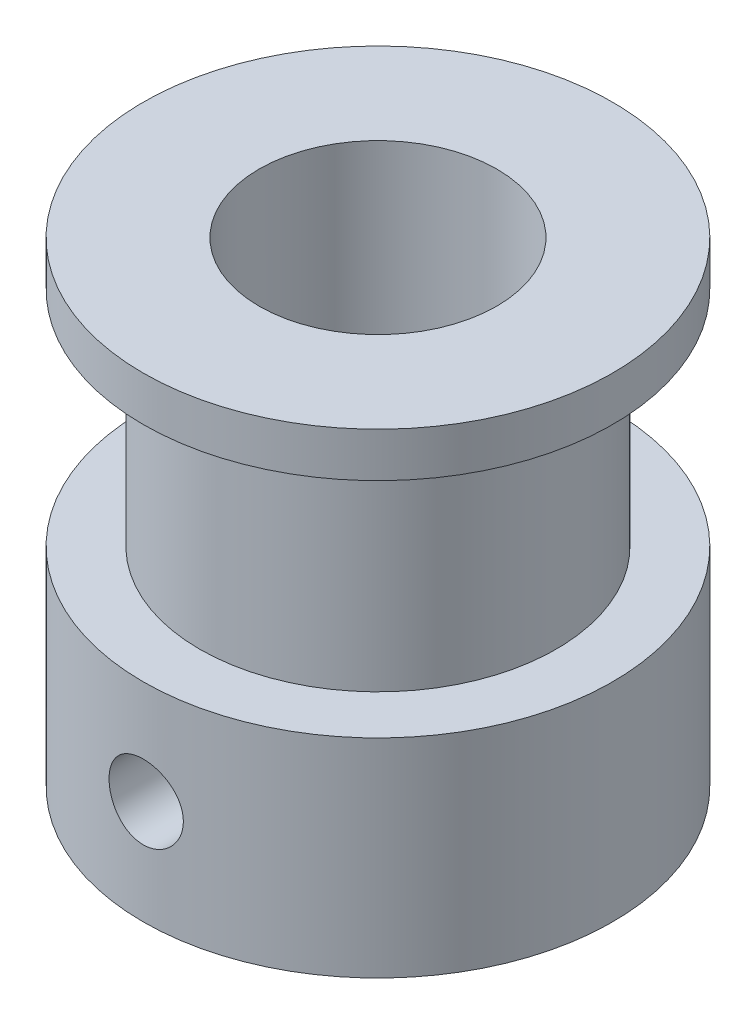
from build123d import *

# Parameters (mm, degrees)
CROQUIS1_R              = 7.9
SALIENTE_EXTRUIR1_DEPTH = 7
CROQUIS2_R              = 6
SALIENTE_EXTRUIR2_DEPTH = 7.5
CROQUIS3_R              = 7.9
SALIENTE_EXTRUIR3_DEPTH = 1.5
CROQUIS4_R              = 4
CORTAR_EXTRUIR1_DEPTH   = 20.514609912
CROQUIS5_W              = 1.25
CROQUIS5_H              = 7.901
MATRIZC1_COUNT          = 2
MATRIZC1_ANGLE          = 90


with BuildPart() as part:
    # Croquis1 → Saliente-Extruir1 (new body)
    with BuildSketch(Plane(origin=(0, 0, 0), x_dir=(1, 0, 0), z_dir=(0, 1, 0))):
        with Locations(Location((0, 0, 0), (0, 0, 270))):
            Circle(CROQUIS1_R)
    extrude(amount=SALIENTE_EXTRUIR1_DEPTH)

    # Croquis2 → Saliente-Extruir2 (add)
    with BuildSketch(Plane(origin=(0, 7, 0), x_dir=(1, 0, 0), z_dir=(0, 1, 0))):
        with Locations(Location((0, 0, 0), (0, 0, 270))):
            Circle(CROQUIS2_R)
    extrude(amount=SALIENTE_EXTRUIR2_DEPTH)

    # Croquis3 → Saliente-Extruir3 (add)
    with BuildSketch(Plane(origin=(0, 14.5, 0), x_dir=(1, 0, 0), z_dir=(0, 1, 0))):
        with Locations(Location((0, 0, 0), (0, 0, 270))):
            Circle(CROQUIS3_R)
    extrude(amount=SALIENTE_EXTRUIR3_DEPTH)

    # Croquis4 → Cortar-Extruir1 (cut, through all)
    with BuildSketch(Plane(origin=(0, 16, 0), x_dir=(1, 0, 0), z_dir=(0, 1, 0))):
        with Locations(Location((0, 0, 0), (0, 0, 270))):
            Circle(CROQUIS4_R)
    extrude(amount=-CORTAR_EXTRUIR1_DEPTH, mode=Mode.SUBTRACT)

    # Croquis5 → Taladro roscado M31 (definir posicio) (revolve, cut)
    with BuildSketch(Plane(origin=(0, 3.5, 0), x_dir=(0, 1, 0), z_dir=(1, 0, 0))):
        with Locations((0.625, 3.9505)):
            Rectangle(CROQUIS5_W, CROQUIS5_H)
    taladro_roscado_m31_definir_posicio = revolve(axis=Axis((0, 3.5, -6.35), (0, 0, 1)), mode=Mode.SUBTRACT)

    # MatrizC1: Taladro roscado M31 (definir posicio) ×2 about axis
    matrizc1_axis = Axis((0, 7, 0), (0, -1, 0))
    for i in range(1, MATRIZC1_COUNT):
        add(taladro_roscado_m31_definir_posicio.rotate(matrizc1_axis, i * MATRIZC1_ANGLE / (MATRIZC1_COUNT - 1)), mode=Mode.SUBTRACT)


solid = part.part
